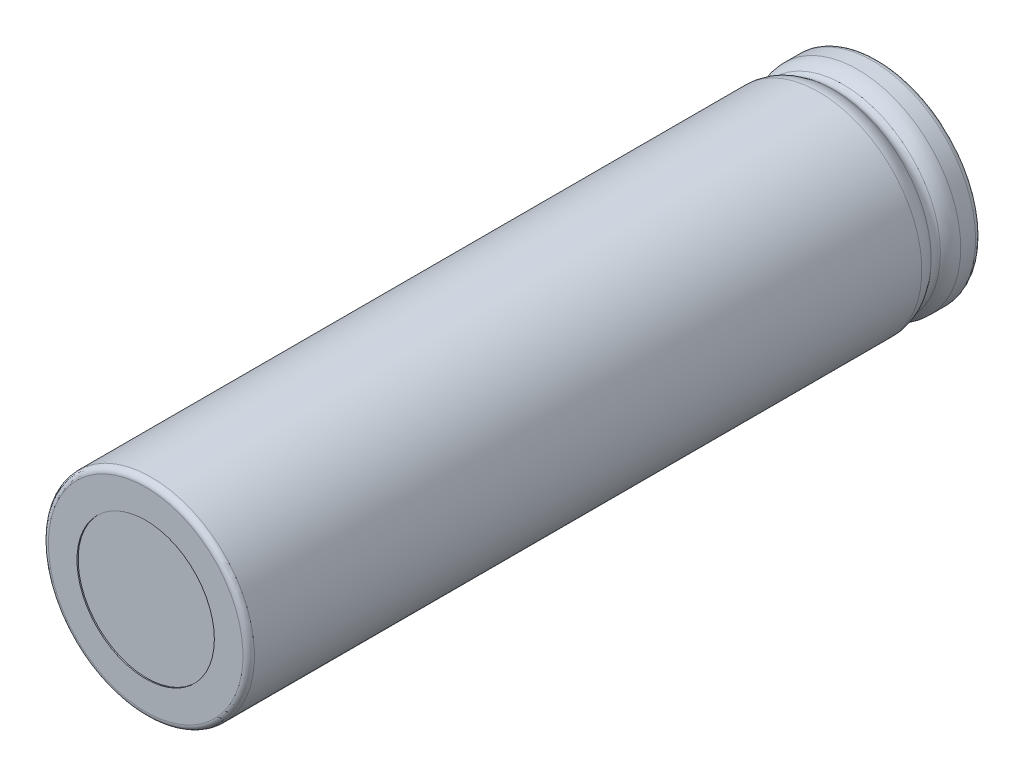
from build123d import *

# Parameters (mm, degrees)
FILLET1_R          = 0.5
FILLET2_R          = 2
FILLET3_R          = 0.2
SKETCH3_R          = 6
CUT_EXTRUDE1_DEPTH = 0.1
SKETCH4_R          = 7.5
SKETCH4_R_2        = 3.1
CUT_EXTRUDE2_DEPTH = 0.1


with BuildPart() as part:
    # Sketch2 → Revolve1 (revolve)
    with BuildSketch(Plane(origin=(0, 0, 0), x_dir=(0, 0, -1), z_dir=(1, 0, 0)), mode=Mode.PRIVATE) as revolve1_sk:
        with BuildLine():
            Line((0, 0), (0, 9))
            Line((0, 9), (59.875, 9))
            ThreePointArc((59.875, 9), (60.5, 8.375), (61.125, 9))
            Line((61.125, 9), (64, 9))
            Line((64, 9), (64, 3.075))
            Line((64, 3.075), (65, 3.075))
            Line((65, 3.075), (65, 0))
            Line((65, 0), (0, 0))
        make_face()
    revolve(revolve1_sk.sketch.rotate(Axis((0, 0, 1000), (0, 0, -1)), 90), axis=Axis((0, 0, 1000), (0, 0, -1)))

    # Fillet1
    fillet1_edges = [part.edges().sort_by_distance(p)[0] for p in [
        (-9, 0, 0),
        (-9, 0, -64),
    ]]
    fillet(fillet1_edges, radius=FILLET1_R)

    # Fillet2
    fillet2_edges = [part.edges().sort_by_distance(p)[0] for p in [
        (-9, 0, -59.875),
        (-9, 0, -61.125),
    ]]
    fillet(fillet2_edges, radius=FILLET2_R)

    # Fillet3
    fillet3_edges = [part.edges().sort_by_distance(p)[0] for p in [
        (-3.075, 0, -65),
    ]]
    fillet(fillet3_edges, radius=FILLET3_R)

    # Sketch3 → Cut-Extrude1 (cut)
    with BuildSketch(Plane.XY):
        Circle(SKETCH3_R)
    extrude(amount=-CUT_EXTRUDE1_DEPTH, mode=Mode.SUBTRACT)

    # Sketch4 → Cut-Extrude2 (cut)
    with BuildSketch(Plane(origin=(0, 0, -64), x_dir=(-1, 0, 0), z_dir=(0, 0, -1))):
        Circle(SKETCH4_R)
        Circle(SKETCH4_R_2, mode=Mode.SUBTRACT)
    extrude(amount=-CUT_EXTRUDE2_DEPTH, mode=Mode.SUBTRACT)


solid = part.part
